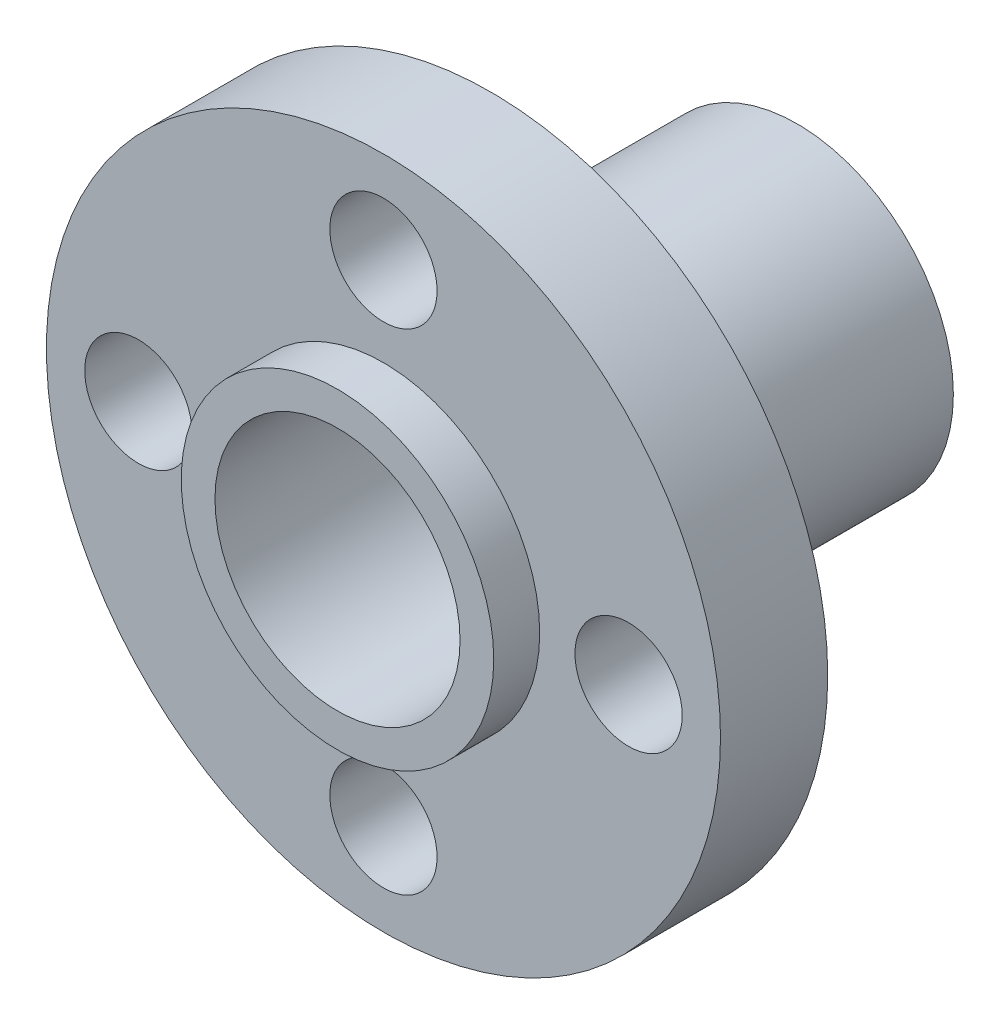
from build123d import *

# Parameters (mm, degrees)
SKETCH1_R                = 11
SKETCH1_R_2              = 5.1
SKETCH1_R_3              = 1.75
BOSS_EXTRUDE1_DEPTH      = 3.5
BOSS_EXTRUDE2_DEPTH      = 1.5
BOSS_EXTRUDE2_DEPTH_BACK = 13.5
SKETCH2_R                = 5.1
SKETCH2_R_2              = 4


with BuildPart() as part:
    # Sketch1 → Boss-Extrude1 (new body)
    with BuildSketch(Plane.XY):
        Circle(SKETCH1_R)
        Circle(SKETCH1_R_2, mode=Mode.SUBTRACT)
        with Locations((0, 8)):
            Circle(SKETCH1_R_3, mode=Mode.SUBTRACT)
        with Locations((8, 0)):
            Circle(SKETCH1_R_3, mode=Mode.SUBTRACT)
        with Locations((0, -8)):
            Circle(SKETCH1_R_3, mode=Mode.SUBTRACT)
        with Locations((-8, 0)):
            Circle(SKETCH1_R_3, mode=Mode.SUBTRACT)
    extrude(amount=-BOSS_EXTRUDE1_DEPTH)

    # Sketch2 → Boss-Extrude2 (add, two sides: drawn at the far end of the back side and taken through both)
    with BuildSketch(Plane.XY.offset(-BOSS_EXTRUDE2_DEPTH_BACK)):
        Circle(SKETCH2_R)
        Circle(SKETCH2_R_2, mode=Mode.SUBTRACT)
    extrude(amount=BOSS_EXTRUDE2_DEPTH + BOSS_EXTRUDE2_DEPTH_BACK)


solid = part.part
